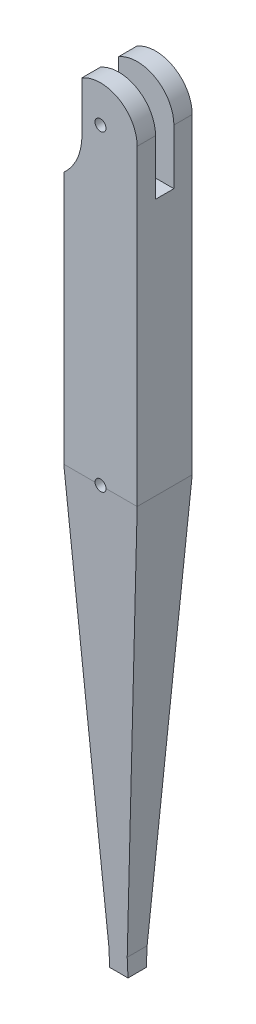
from build123d import *

# Parameters (mm, degrees)
CROQUIS1_R              = 1.5
SALIENTE_EXTRUIR1_DEPTH = 15
CROQUIS2_W              = 5
CROQUIS2_H              = 15
CROQUIS2_H_2            = 35
CORTAR_EXTRUIR1_DEPTH   = 60
CROQUIS4_W              = 5
CROQUIS4_H              = 30
CORTAR_EXTRUIR2_DEPTH   = 15
CORTAR_EXTRUIR3_DEPTH   = 40


with BuildPart() as part:
    # Croquis1 → Saliente-Extruir1 (new body)
    with BuildSketch(Plane.XY):
        with BuildLine():
            Line((10, 0), (10, -85))
            Line((10, -85), (2.49701529, -197.5))
            Line((2.49701529, -197.5), (2.49701529, -202.5))
            Line((2.49701529, -202.5), (-2.49701529, -202.5))
            Line((-2.49701529, -202.5), (-2.49701529, -197.5))
            Line((-2.49701529, -197.5), (-10, -85))
            Line((-10, -85), (-10, 0))
            ThreePointArc((-10, 0), (0, 10), (10, 0))
        make_face()
        with Locations((0, -85)):
            Circle(CROQUIS1_R, mode=Mode.SUBTRACT)
        Circle(CROQUIS1_R, mode=Mode.SUBTRACT)
    extrude(amount=SALIENTE_EXTRUIR1_DEPTH)

    # Croquis2 → Cortar-Extruir1 (cut)
    with BuildSketch(Plane(origin=(10, 0, 0), x_dir=(0, 0, -1), z_dir=(1, 0, 0))):
        with Locations((-7.5, -7.5)):
            Rectangle(CROQUIS2_W, CROQUIS2_H)
        with Locations((-7.5, 17.5)):
            Rectangle(CROQUIS2_W, CROQUIS2_H_2)
        Polygon((-15, -85), (-10, -202.5), (-18.081893827, -208.021253548), align=None)
        Polygon((-5, -202.5), (3.081893827, -208.021253548), (0, -85), align=None)
    extrude(amount=-CORTAR_EXTRUIR1_DEPTH, mode=Mode.SUBTRACT)

    # Croquis4 → Cortar-Extruir2 (cut)
    with BuildSketch(Plane.ZY.offset(10)):
        with Locations((7.5, -85)):
            Rectangle(CROQUIS4_W, CROQUIS4_H)
    extrude(amount=-CORTAR_EXTRUIR2_DEPTH, mode=Mode.SUBTRACT)

    # Croquis5 → Cortar-Extruir3 (cut)
    with BuildSketch(Plane(origin=(0, 0, 0), x_dir=(-1, 0, 0), z_dir=(0, 0, -1))):
        with BuildLine():
            Line((20.047011477, -20), (24.874582677, -20))
            Line((24.874582677, -20), (24.874582677, 13.063406197))
            Line((24.874582677, 13.063406197), (10, 13.063406197))
            Line((10, 13.063406197), (10, 14.482732523))
            Line((10, 14.482732523), (5.047011477, 14.482732523))
            Line((5.047011477, 14.482732523), (5.047011477, -5))
            ThreePointArc((5.047011477, -5), (9.440409759, -15.606601718), (20.047011477, -20))
        make_face()
    extrude(amount=-CORTAR_EXTRUIR3_DEPTH, mode=Mode.SUBTRACT)


solid = part.part
